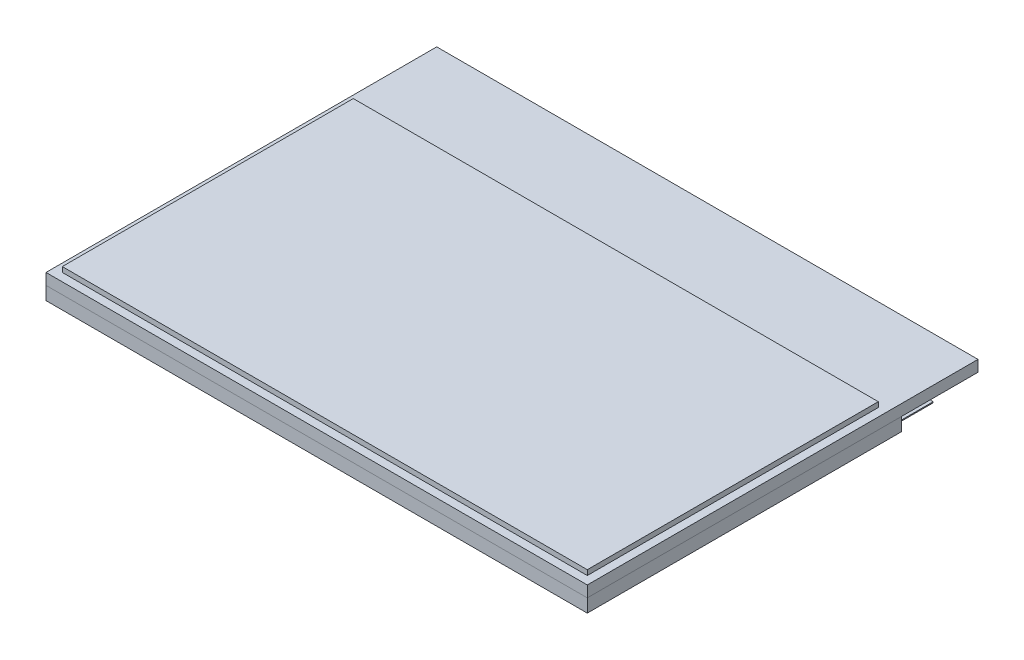
from build123d import *

# Parameters (mm, degrees)
SKETCH1_W           = 26.6
SKETCH1_H           = 19.2
BOSS_EXTRUDE1_DEPTH = 0.55
SKETCH3_W           = 26.6
SKETCH3_H           = 15.45
BOSS_EXTRUDE2_DEPTH = 0.65
SKETCH4_W           = 25.6
SKETCH4_H           = 17
BOSS_EXTRUDE3_DEPTH = 0.05
SKETCH2_W           = 25.8
SKETCH2_H           = 14.3
BOSS_EXTRUDE4_DEPTH = 0.25


with BuildPart() as part:
    # Sketch1 → Boss-Extrude1 (new body)
    with BuildSketch(Plane(origin=(0, 0, 0), x_dir=(1, 0, 0), z_dir=(0, 1, 0))):
        Rectangle(SKETCH1_W, SKETCH1_H)
    extrude(amount=BOSS_EXTRUDE1_DEPTH)


with BuildPart() as body_2:
    # Sketch3 → Boss-Extrude2 (new body)
    with BuildSketch(Plane.XZ):
        with Locations((0, 1.875)):
            Rectangle(SKETCH3_W, SKETCH3_H)
    extrude(amount=BOSS_EXTRUDE2_DEPTH)


with BuildPart() as body_3:
    # Sketch4 → Boss-Extrude3 (new body)
    with BuildSketch(Plane.XZ.offset(0.65)):
        with Locations((0, 0.6)):
            Rectangle(SKETCH4_W, SKETCH4_H)
    extrude(amount=BOSS_EXTRUDE3_DEPTH)


with BuildPart() as body_4:
    # Sketch2 → Boss-Extrude4 (new body)
    with BuildSketch(Plane(origin=(0, 0.55, 0), x_dir=(1, 0, 0), z_dir=(0, 1, 0))):
        with Locations((0, -2.05)):
            Rectangle(SKETCH2_W, SKETCH2_H)
    extrude(amount=BOSS_EXTRUDE4_DEPTH)


solid = Compound([part.part, body_2.part, body_3.part, body_4.part])
